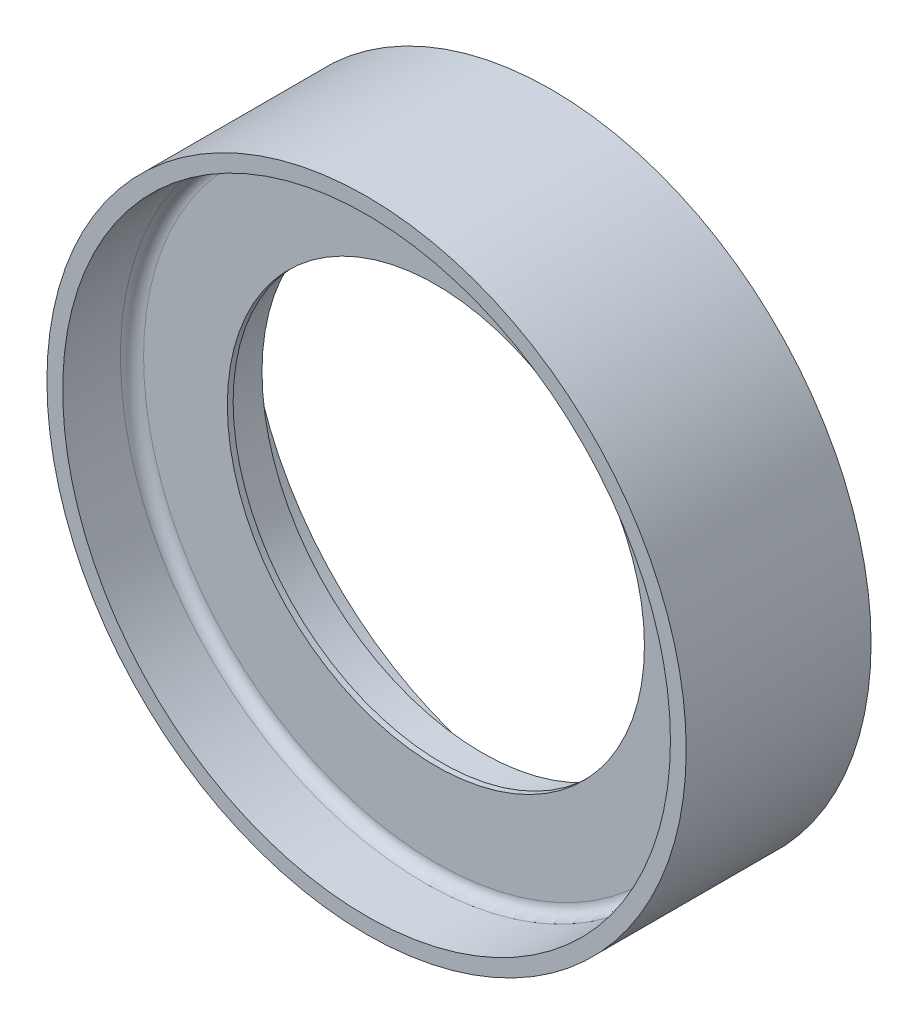
from build123d import *

# Parameters (mm, degrees)
SKETCH1_R           = 13.8327
SKETCH1_R_2         = 13.15
BOSS_EXTRUDE1_DEPTH = 3
BOSS_EXTRUDE2_START = 2
SKETCH2_R           = 13.8327
SKETCH2_R_2         = 9.025
BOSS_EXTRUDE2_DEPTH = 2
BOSS_EXTRUDE3_START = 3
SKETCH3_R           = 13.8327
SKETCH3_R_2         = 13.15
BOSS_EXTRUDE3_DEPTH = 3
FILLET1_R           = 0.5
SKETCH4_R           = 9.525
CUT_EXTRUDE2_DEPTH  = 1.75


with BuildPart() as part:
    # Sketch1 → Boss-Extrude1 (new body)
    with BuildSketch(Plane.XY):
        Circle(SKETCH1_R)
        Circle(SKETCH1_R_2, mode=Mode.SUBTRACT)
    extrude(amount=-BOSS_EXTRUDE1_DEPTH)

    # Sketch2 → Boss-Extrude2 (add)
    with BuildSketch(Plane.XY.offset(BOSS_EXTRUDE2_START)):
        Circle(SKETCH2_R)
        Circle(SKETCH2_R_2, mode=Mode.SUBTRACT)
    extrude(amount=-BOSS_EXTRUDE2_DEPTH)

    # Sketch3 → Boss-Extrude3 (add)
    with BuildSketch(Plane.XY.offset(2).offset(BOSS_EXTRUDE3_START)):
        Circle(SKETCH3_R)
        Circle(SKETCH3_R_2, mode=Mode.SUBTRACT)
    extrude(amount=-BOSS_EXTRUDE3_DEPTH)

    # Fillet1
    fillet1_edges = [part.edges().sort_by_distance(p)[0] for p in [
        (-13.15, 0, 2),
        (-13.15, 0, 0),
    ]]
    fillet(fillet1_edges, radius=FILLET1_R)

    # Sketch4 → Cut-Extrude2 (cut)
    with BuildSketch(Plane(origin=(0, 0, 0), x_dir=(-1, 0, 0), z_dir=(0, 0, -1))):
        Circle(SKETCH4_R)
    extrude(amount=-CUT_EXTRUDE2_DEPTH, mode=Mode.SUBTRACT)


solid = part.part
